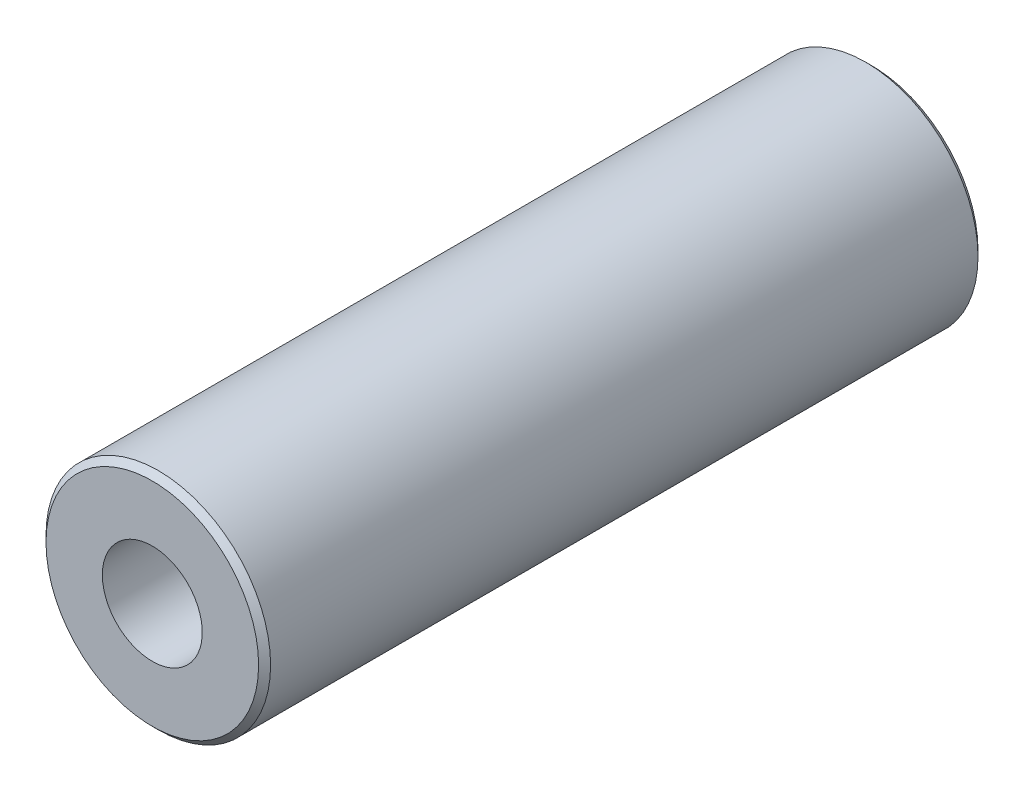
from build123d import *

# Parameters (mm, degrees)
SKETCH1_R           = 7.1374
SKETCH1_R_2         = 3.175
BOSS_EXTRUDE1_DEPTH = 22.86
CHAMFER1_SIZE       = 0.381


with BuildPart() as part:
    # Sketch1 → Boss-Extrude1 (new, symmetric)
    with BuildSketch(Plane.XY):
        Circle(SKETCH1_R)
        Circle(SKETCH1_R_2, mode=Mode.SUBTRACT)
    extrude(amount=BOSS_EXTRUDE1_DEPTH, both=True)

    # Chamfer1
    chamfer1_edges = [part.edges().sort_by_distance(p)[0] for p in [
        (-7.1374, 0, -22.86),
        (-7.1374, 0, 22.86),
    ]]
    chamfer(chamfer1_edges, length=CHAMFER1_SIZE)


solid = part.part
